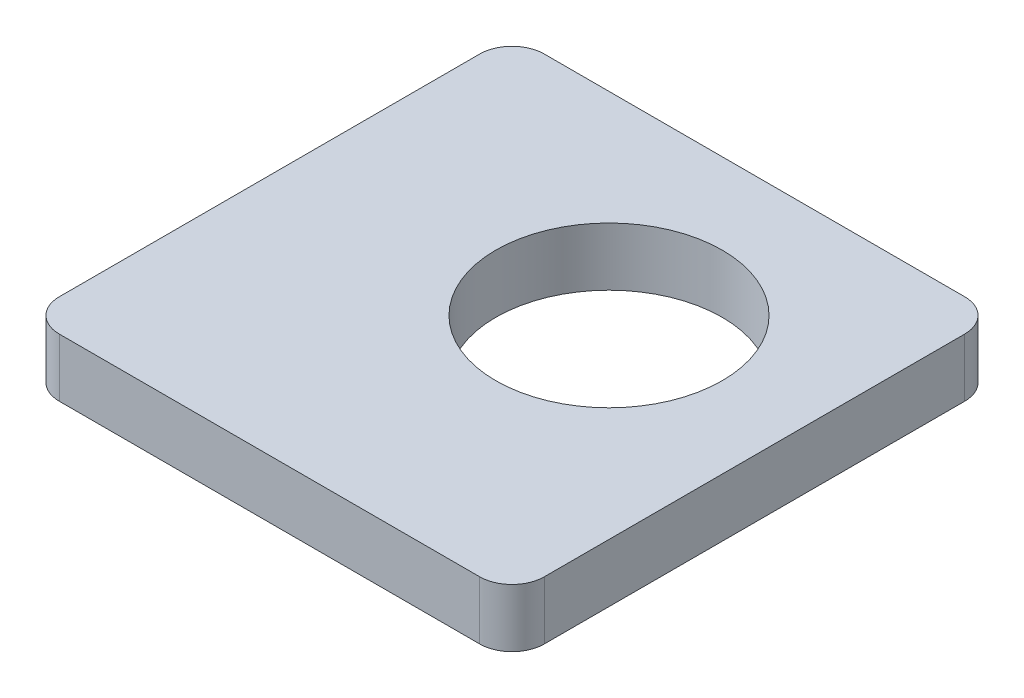
from build123d import *

# Parameters (mm, degrees)
SKETCH_1_W      = 150
SKETCH_1_H      = 150
SKETCH_1_R      = 35
EXTRUDE_1_DEPTH = 18
FILLET_1_R      = 10


with BuildPart() as part:
    # 草图1 → 凸台-拉伸1 (new body)
    with BuildSketch(Plane(origin=(0, 0, 0), x_dir=(1, 0, 0), z_dir=(0, 1, 0))):
        Rectangle(SKETCH_1_W, SKETCH_1_H)
        with Locations(Location((15, 15, 0), (0, 0, 270))):
            Circle(SKETCH_1_R, mode=Mode.SUBTRACT)
    extrude(amount=EXTRUDE_1_DEPTH)

    # 圆角1
    fillet_1_edges = [part.edges().sort_by_distance(p)[0] for p in [
        (-75, 9, -75),
        (75, 9, -75),
        (75, 9, 75),
        (-75, 9, 75),
    ]]
    fillet(fillet_1_edges, radius=FILLET_1_R)


solid = part.part
